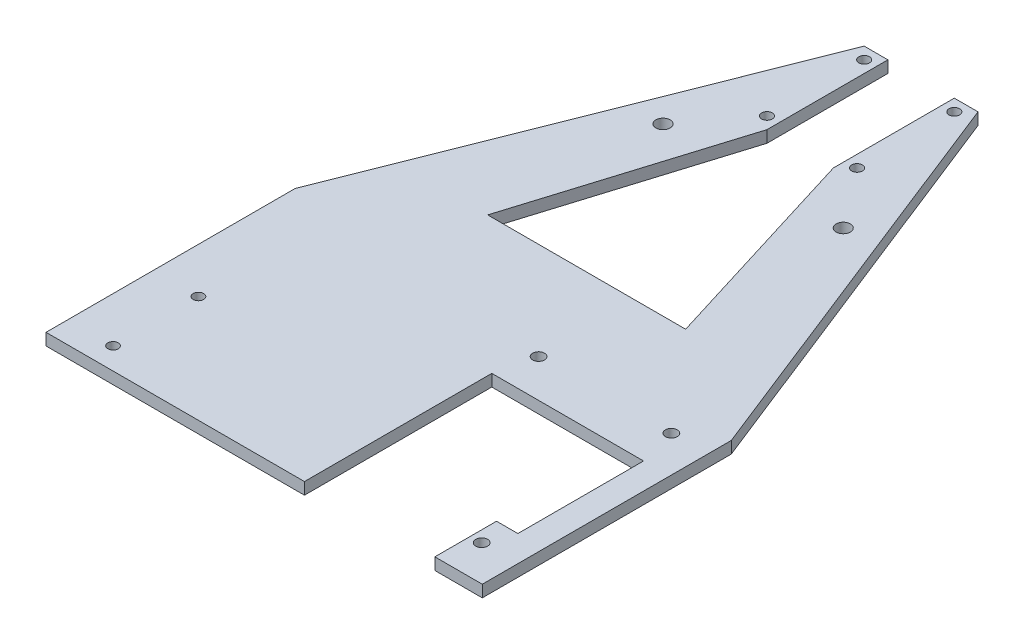
from build123d import *

# Parameters (mm, degrees)
SKETCH1_R           = 2.5
SKETCH1_R_2         = 2.25
SKETCH1_R_3         = 3
SKETCH1_R_4         = 2.2
BOSS_EXTRUDE1_DEPTH = 5


with BuildPart() as part:
    # Sketch1 → Boss-Extrude1 (new body)
    with BuildSketch(Plane(origin=(0, 0, 0), x_dir=(1, 0, 0), z_dir=(0, 1, 0))):
        Polygon((-91.72214446, -4.653561253), (-91.72214446, 90.346388656), (-23.72214446, 262.395827557), (-13.72214446, 262.395827557), (-13.72214446, 211.395827557), (-41.469832452, 121.346438747), (42.025543532, 121.346438747), (14.27785554, 211.395827557), (14.27785554, 262.395827557), (24.27785554, 262.395827557), (92.27785554, 90.346388656), (92.27785554, -4.653561253), (92.27785554, -10.433561253), (92.27785554, -14.668275992), (72.27785554, -14.668275992), (72.27785554, -10.433561253), (72.27785554, -4.653561253), (72.27785554, 11.346431169), (81.27785554, 11.346431169), (81.27785554, 64.346431169), (17.277798113, 64.346431169), (17.277798113, -4.653561253), (17.277798113, -10.433561253), (17.277798113, -14.668275992), (-91.456714597, -14.668275992), (-91.72214446, -14.668275992), (-91.72214446, -10.433561253), align=None)
        with Locations(Location((77.010414368, 0.346438747, 0), (0, 0, 270))):
            Circle(SKETCH1_R, mode=Mode.SUBTRACT)
        with Locations(Location((77.010414368, 80.346438747, 0), (0, 0, 270))):
            Circle(SKETCH1_R, mode=Mode.SUBTRACT)
        with Locations(Location((21.010414368, 80.346438747, 0), (0, 0, 270))):
            Circle(SKETCH1_R, mode=Mode.SUBTRACT)
        with Locations(Location((-18.72214446, 257.395827557, 0), (0, 0, 270))):
            Circle(SKETCH1_R_2, mode=Mode.SUBTRACT)
        with Locations(Location((-18.72214446, 216.395827557, 0), (0, 0, 270))):
            Circle(SKETCH1_R_2, mode=Mode.SUBTRACT)
        with Locations(Location((19.27785554, 257.395827557, 0), (0, 0, 270))):
            Circle(SKETCH1_R_2, mode=Mode.SUBTRACT)
        with Locations(Location((19.27785554, 216.395827557, 0), (0, 0, 270))):
            Circle(SKETCH1_R_2, mode=Mode.SUBTRACT)
        with Locations(Location((-37.72214446, 191.551940951, 0), (0, 0, 270))):
            Circle(SKETCH1_R_3, mode=Mode.SUBTRACT)
        with Locations(Location((38.27785554, 191.551940951, 0), (0, 0, 270))):
            Circle(SKETCH1_R_3, mode=Mode.SUBTRACT)
        with Locations(Location((-72.656714597, -5.450648645, 0), (0, 0, 270))):
            Circle(SKETCH1_R_4, mode=Mode.SUBTRACT)
        with Locations(Location((-72.656714597, 30.549351355, 0), (0, 0, 270))):
            Circle(SKETCH1_R_4, mode=Mode.SUBTRACT)
    extrude(amount=BOSS_EXTRUDE1_DEPTH)


solid = part.part
